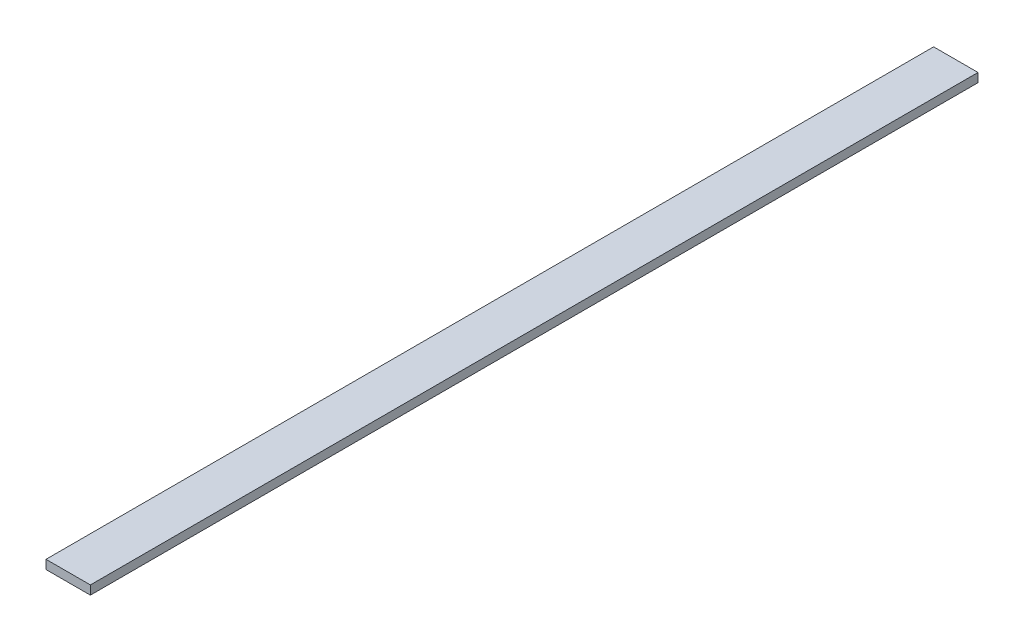
from build123d import *

# Parameters (mm, degrees)
SKETCH1_W           = 10
SKETCH1_H           = 200
BOSS_EXTRUDE1_DEPTH = 2


with BuildPart() as part:
    # Sketch1 → Boss-Extrude1 (new body)
    with BuildSketch(Plane(origin=(0, 0, 0), x_dir=(1, 0, 0), z_dir=(0, 1, 0))):
        with Locations((5, 100)):
            Rectangle(SKETCH1_W, SKETCH1_H)
    extrude(amount=BOSS_EXTRUDE1_DEPTH)


solid = part.part
